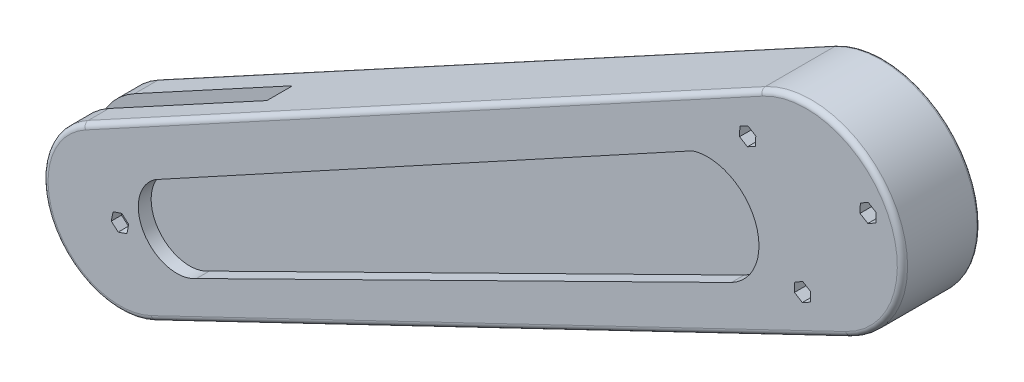
from build123d import *

# Parameters (mm, degrees)
BOSS_EXTRUDE1_DEPTH = 30
FILLET1_R           = 2
FILLET2_R           = 1
SKETCH6_W           = 100
SKETCH6_H           = 10
CUT_EXTRUDE3_DEPTH  = 129
CUT_EXTRUDE4_DEPTH  = 4
SKETCH8_R           = 1.9
CUT_EXTRUDE6_DEPTH  = 112
CUT_EXTRUDE7_DEPTH  = 5
CUT_EXTRUDE8_DEPTH  = 20
CUT_EXTRUDE9_START  = -70
SKETCH10_R          = 1.75
CUT_EXTRUDE9_DEPTH  = 71
CIRPATTERN1_COUNT   = 3


with BuildPart() as part:
    # Sketch1 → Boss-Extrude1 (new body)
    with BuildSketch(Plane.XY):
        with BuildLine():
            Line((-281.432373232, -110.20807274), (-17.900575614, 32.951773741))
            ThreePointArc((-17.900575614, 32.951773741), (33.388989093, 17.071186467), (16.23112616, -33.805333064))
            Line((16.23112616, -33.805333064), (-254.127011813, -163.613758184))
            ThreePointArc((-254.127011813, -163.613758184), (-293.823104015, -150.226440906), (-281.432373232, -110.20807274))
        make_face()
    extrude(amount=BOSS_EXTRUDE1_DEPTH)

    # Fillet1
    fillet1_edges = [part.edges().sort_by_distance(p)[0] for p in [
        (33.388989093, 17.071186467, 30),
        (-149.666474423, -38.628149499, 30),
        (-293.823104015, -150.226440906, 30),
        (-118.947942827, -98.709545624, 30),
    ]]
    fillet(fillet1_edges, radius=FILLET1_R)

    # Fillet2
    fillet2_edges = [part.edges().sort_by_distance(p)[0] for p in [
        (-149.666474423, -38.628149499, 0),
        (33.388989093, 17.071186467, 0),
        (-118.947942827, -98.709545624, 0),
        (-293.823104015, -150.226440906, 0),
    ]]
    fillet(fillet2_edges, radius=FILLET2_R)

    # Sketch6 → Cut-Extrude3 (cut)
    with BuildSketch(Plane(origin=(-17.900575614, 32.951773741, 0), x_dir=(0.8787139664263899, 0.4773486830475195, 0), z_dir=(-0.47734868304751954, 0.87871396642639, 0))):
        with Locations((-279.906235347, -15)):
            Rectangle(SKETCH6_W, SKETCH6_H)
    extrude(amount=-CUT_EXTRUDE3_DEPTH, mode=Mode.SUBTRACT)

    # Sketch7 → Cut-Extrude4 (cut)
    with BuildSketch(Plane.XY.offset(30)):
        Polygon((-263.720924854, -135.421623642), (-266.410501723, -133.058876034), (-269.80148961, -134.206744124), (-270.502900627, -137.717359822), (-267.813323758, -140.080107431), (-264.422335871, -138.932239341), align=None)
    cut_extrude4 = extrude(amount=-CUT_EXTRUDE4_DEPTH, mode=Mode.SUBTRACT)

    # Sketch8 → Cut-Extrude6 (cut)
    with BuildSketch(Plane.XY.offset(26)):
        with Locations((-267.111912741, -136.569491732)):
            Circle(SKETCH8_R)
    extrude(amount=-CUT_EXTRUDE6_DEPTH, mode=Mode.SUBTRACT)

    # Mirror1: Cut-Extrude4 across plane
    add(cut_extrude4.mirror(Plane.XY.offset(15)), mode=Mode.SUBTRACT)

    # Sketch9 → Cut-Extrude7 (cut)
    with BuildSketch(Plane.XY.offset(30)):
        with BuildLine():
            Line((-253.373411521, -115.147546234), (-44.145606003, -0.832397564))
            ThreePointArc((-44.145606003, -0.832397564), (-19.838333174, -12.433391688), (-29.122969005, -37.716233984))
            Line((-29.122969005, -37.716233984), (-237.324421153, -140.479268617))
            ThreePointArc((-237.324421153, -140.479268617), (-257.658147226, -135.611958389), (-253.373411521, -115.147546234))
        make_face()
    cut_extrude7 = extrude(amount=-CUT_EXTRUDE7_DEPTH, mode=Mode.SUBTRACT)

    # Mirror2: Cut-Extrude7 across plane
    add(cut_extrude7.mirror(Plane.XY.offset(15)), mode=Mode.SUBTRACT)

    # Sketch3 → Cut-Extrude8 (cut)
    with BuildSketch(Plane.XY.offset(30)):
        Polygon((-4.424109202, -25.18892785), (-4.53581637, -28.767184619), (-1.492808691, -30.65305425), (1.661906157, -28.96066711), (1.773613325, -25.382410341), (-1.269394354, -23.496540711), align=None)
        Polygon((27.292728029, 14.033716876), (24.249720349, 15.919586506), (21.095005502, 14.227199366), (20.983298334, 10.648942597), (24.026306013, 8.763072967), (27.181020861, 10.455460106), align=None)
        Polygon((-19.602196811, 16.425854883), (-22.645204491, 18.311724513), (-25.799919338, 16.619337374), (-25.911626506, 13.041080604), (-22.868618827, 11.155210974), (-19.713903979, 12.847598114), align=None)
    extrude(amount=-CUT_EXTRUDE8_DEPTH, mode=Mode.SUBTRACT)

    # Sketch10 → Cut-Extrude9 (cut)
    with BuildSketch(Plane.XY.offset(10).offset(CUT_EXTRUDE9_START)):
        with Locations((24.040072147, 12.291254256)):
            Circle(SKETCH10_R)
    cut_extrude9 = extrude(amount=CUT_EXTRUDE9_DEPTH, mode=Mode.SUBTRACT)

    # CirPattern1: Cut-Extrude9 ×3 about axis
    cirpattern1_axis = Axis((0, 0, 0), (0, 0, 1))
    for i in range(1, CIRPATTERN1_COUNT):
        add(cut_extrude9.rotate(cirpattern1_axis, i * 360 / CIRPATTERN1_COUNT), mode=Mode.SUBTRACT)


solid = part.part
